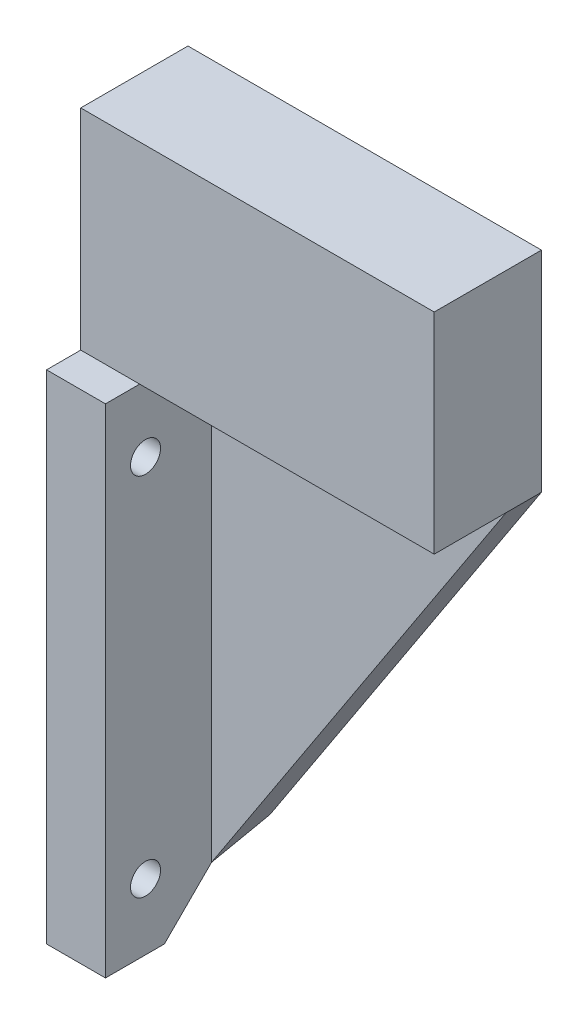
from build123d import *

# Parameters (mm, degrees)
SKETCH1_R           = 1.275
BOSS_EXTRUDE1_DEPTH = 5
SKETCH2_W           = 9.1
SKETCH2_H           = 17.8
BOSS_EXTRUDE2_DEPTH = 25
BOSS_EXTRUDE3_DEPTH = 3
CUT_EXTRUDE1_DEPTH  = 15


with BuildPart() as part:
    # Sketch1 → Boss-Extrude1 (new body)
    # profile 1 of 2: a face of its own
    with BuildSketch(Plane(origin=(0, 0, 0), x_dir=(0, 0, -1), z_dir=(1, 0, 0))):
        Polygon((-4.381647728, -34.17856484), (-0.382647728, -30.17956484), (-0.382647728, 8.02143516), (-6.482647728, 8.02143516), (-9.382647728, 8.02143516), (-9.382647728, -34.17856484), align=None)
        with Locations((-5.982647728, 2.42143516)):
            Circle(SKETCH1_R, mode=Mode.SUBTRACT)
        with Locations((-5.982647728, -28.57856484)):
            Circle(SKETCH1_R, mode=Mode.SUBTRACT)
    # profile 2 of 2: a face of its own
    with BuildSketch(Plane(origin=(0, 0, 0), x_dir=(0, 0, -1), z_dir=(1, 0, 0))):
        Polygon((2.617352272, 8.02143516), (2.617352272, 25.82143516), (-6.482647728, 25.82143516), (-6.482647728, 8.02143516), (-0.382647728, 8.02143516), align=None)
    extrude(amount=BOSS_EXTRUDE1_DEPTH)

    # Sketch2 → Boss-Extrude2 (add)
    with BuildSketch(Plane(origin=(5, 0, 0), x_dir=(0, 0, -1), z_dir=(1, 0, 0))):
        with Locations((-1.932647728, 16.92143516)):
            Rectangle(SKETCH2_W, SKETCH2_H)
    extrude(amount=BOSS_EXTRUDE2_DEPTH)

    # Sketch3 → Boss-Extrude3 (add)
    with BuildSketch(Plane(origin=(0, 0, 0.382647728), x_dir=(-1, 0, 0), z_dir=(0, 0, -1))):
        Polygon((-30, 8.02143516), (0, 8.02143516), (0, -30.17956484), (-5, -30.17956484), align=None)
    extrude(amount=BOSS_EXTRUDE3_DEPTH)

    # Sketch4 → Cut-Extrude1 (cut, symmetric)
    with BuildSketch(Plane(origin=(5, 0, 0), x_dir=(0, 0, -1), z_dir=(1, 0, 0))):
        Polygon((-0.382647728, -30.17956484), (2.617352272, -27.17956484), (2.617352272, -30.17956484), align=None)
    extrude(amount=CUT_EXTRUDE1_DEPTH, both=True, mode=Mode.SUBTRACT)


solid = part.part
